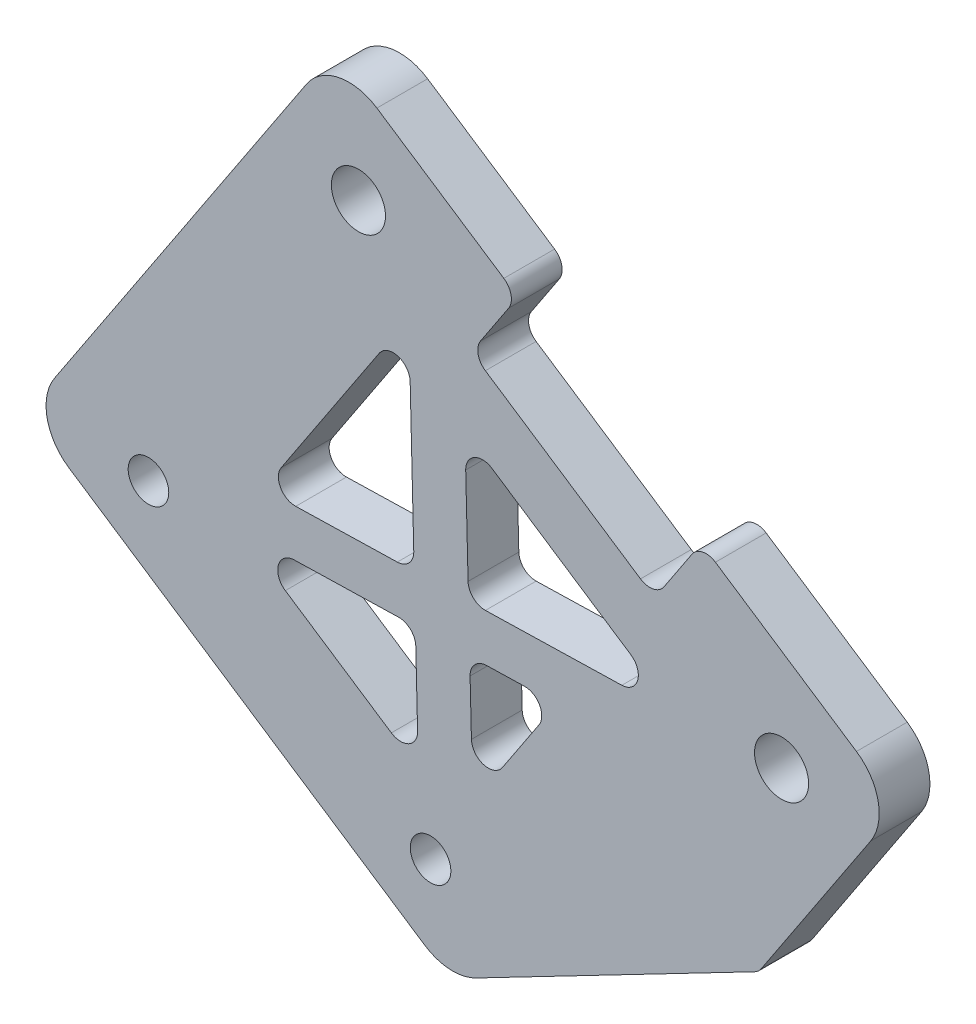
from build123d import *

# Parameters (mm, degrees)
EXTRUDE_1_DEPTH = 3
SKETCH_2_R      = 2.1
SKETCH_2_R_2    = 1.2
EXTRUDE_2_DEPTH = 3


with BuildPart() as part:
    # 草图1 → 凸台-拉伸1 (new body)
    with BuildSketch(Plane.XY):
        with BuildLine():
            Line((0.798434478, -20.883817003), (17.2756604, -12.326264758))
            ThreePointArc((17.2756604, -12.326264758), (17.48353375, -12.18227786), (17.648643158, -11.990751257))
            Line((17.648643158, -11.990751257), (24.128865743, -2.200202913))
            ThreePointArc((24.128865743, -2.200202913), (24.566982391, 0.053711846), (23.283019233, 1.957265509))
            Line((23.283019233, 1.957265509), (14.944161012, 7.476635362))
            ThreePointArc((14.944161012, 7.476635362), (14.192856092, 7.622674245), (13.558338205, 7.194686526))
            Line((13.558338205, 7.194686526), (11.902527249, 4.693029059))
            ThreePointArc((11.902527249, 4.693029059), (11.268009361, 4.26504134), (10.516704441, 4.411080223))
            Line((10.516704441, 4.411080223), (1.343960399, 10.482387061))
            ThreePointArc((1.343960399, 10.482387061), (0.915972679, 11.116904949), (1.062011562, 11.868209869))
            Line((1.062011562, 11.868209869), (2.717822518, 14.369867335))
            ThreePointArc((2.717822518, 14.369867335), (2.8638614, 15.121172254), (2.435873681, 15.755690142))
            Line((2.435873681, 15.755690142), (-5.069098717, 20.72312301))
            ThreePointArc((-5.069098717, 20.72312301), (-7.323013477, 21.161239658), (-9.22656714, 19.8772765))
            Line((-9.22656714, 19.8772765), (-24.128865743, -2.637640696))
            ThreePointArc((-24.128865743, -2.637640696), (-24.566982391, -4.891555455), (-23.283019233, -6.795109118))
            Line((-23.283019233, -6.795109118), (-2.240085668, -20.72312301))
            ThreePointArc((-2.240085668, -20.72312301), (-0.742710136, -21.217278992), (0.798434478, -20.883817003))
        make_face()
        with BuildLine():
            Line((3.65242583, -4.518851403), (1.415541705, -4.574406046))
            ThreePointArc((1.415541705, -4.574406046), (0.956150335, -4.699151193), (0.606483954, -5.022160797))
            ThreePointArc((0.606483954, -5.022160797), (0.479294259, -5.297811966), (0.44067804, -5.598925853))
            Line((0.44067804, -5.598925853), (0.520246584, -8.802719514))
            ThreePointArc((0.520246584, -8.802719514), (1.243652504, -9.738966959), (2.353824142, -9.329828428))
            Line((2.353824142, -9.329828428), (4.511139723, -6.070480125))
            ThreePointArc((4.511139723, -6.070480125), (4.55220049, -5.034323699), (3.65242583, -4.518851403))
        make_face(mode=Mode.SUBTRACT)
        with BuildLine():
            Line((-3.794049487, -4.70379003), (-9.955030272, -4.856802465))
            ThreePointArc((-9.955030272, -4.856802465), (-10.414421641, -4.981547612), (-10.764088023, -5.304557216))
            ThreePointArc((-10.764088023, -5.304557216), (-10.910126905, -6.055862136), (-10.482139186, -6.690380023))
            Line((-10.482139186, -6.690380023), (-4.214325339, -10.838955509))
            ThreePointArc((-4.214325339, -10.838955509), (-3.178168913, -10.880016276), (-2.662696618, -9.980241616))
            Line((-2.662696618, -9.980241616), (-2.76952968, -5.678653695))
            ThreePointArc((-2.76952968, -5.678653695), (-3.079888708, -4.979036863), (-3.794049487, -4.70379003))
        make_face(mode=Mode.SUBTRACT)
        with BuildLine():
            Line((1.346368171, -1.789163051), (9.413331456, -1.588814155))
            ThreePointArc((9.413331456, -1.588814155), (10.349578901, -0.865408235), (9.94044037, 0.244763403))
            Line((9.94044037, 0.244763403), (1.733593774, 5.676756668))
            ThreePointArc((1.733593774, 5.676756668), (0.982288854, 5.822795551), (0.347770967, 5.394807831))
            ThreePointArc((0.347770967, 5.394807831), (0.220581273, 5.119156662), (0.181965053, 4.818042775))
            Line((0.181965053, 4.818042775), (0.321848364, -0.814299386))
            ThreePointArc((0.321848364, -0.814299386), (0.632207392, -1.513916218), (1.346368171, -1.789163051))
        make_face(mode=Mode.SUBTRACT)
        with BuildLine():
            Line((-9.867573328, -2.067669438), (-3.863223021, -1.918547035))
            ThreePointArc((-3.863223021, -1.918547035), (-3.163606189, -1.608188007), (-2.888359356, -0.894027228))
            Line((-2.888359356, -0.894027228), (-3.10194101, 7.705747447))
            ThreePointArc((-3.10194101, 7.705747447), (-3.82534693, 8.641994892), (-4.935518568, 8.232856362))
            Line((-4.935518568, 8.232856362), (-10.726287221, -0.516040717))
            ThreePointArc((-10.726287221, -0.516040717), (-10.767347988, -1.552197143), (-9.867573328, -2.067669438))
        make_face(mode=Mode.SUBTRACT)
        with BuildLine():
            ThreePointArc((17.521345347, -0.225190454), (17.972463486, -2.442506946), (20.189779977, -1.991388807))
            ThreePointArc((20.189779977, -1.991388807), (19.738661839, 0.225927685), (17.521345347, -0.225190454))
        make_face(mode=Mode.SUBTRACT)
        with BuildLine():
            ThreePointArc((-3.64705761, -14.995048823), (-3.054965053, -17.905276719), (-0.144737158, -17.313184161))
            ThreePointArc((-0.144737158, -17.313184161), (-0.736829715, -14.402956266), (-3.64705761, -14.995048823))
        make_face(mode=Mode.SUBTRACT)
        with BuildLine():
            ThreePointArc((-20.324774052, -3.956309117), (-19.732681494, -6.866537012), (-16.822453599, -6.274444455))
            ThreePointArc((-16.822453599, -6.274444455), (-17.414546156, -3.36421656), (-20.324774052, -3.956309117))
        make_face(mode=Mode.SUBTRACT)
        with BuildLine():
            ThreePointArc((-7.495229315, 16.332919105), (-7.044111176, 14.115602614), (-4.826794685, 14.566720752))
            ThreePointArc((-4.826794685, 14.566720752), (-5.277912823, 16.784037244), (-7.495229315, 16.332919105))
        make_face(mode=Mode.SUBTRACT)
    extrude(amount=EXTRUDE_1_DEPTH)

    # 草图2 → 凸台-拉伸2 (add)
    # profile 1 of 2: a face of its own
    with BuildSketch(Plane(origin=(0, 0, 0), x_dir=(-1, 0, 0), z_dir=(0, 0, -1))):
        with Locations((1.895897384, -16.154116492)):
            Circle(SKETCH_2_R)
        with Locations((1.895897384, -16.154116492)):
            Circle(SKETCH_2_R_2, mode=Mode.SUBTRACT)
    # profile 2 of 2: a face of its own
    with BuildSketch(Plane(origin=(0, 0, 0), x_dir=(-1, 0, 0), z_dir=(0, 0, -1))):
        with Locations((18.573613825, -5.115376786)):
            Circle(SKETCH_2_R)
        with Locations((18.573613825, -5.115376786)):
            Circle(SKETCH_2_R_2, mode=Mode.SUBTRACT)
    extrude(amount=-EXTRUDE_2_DEPTH)


solid = part.part
